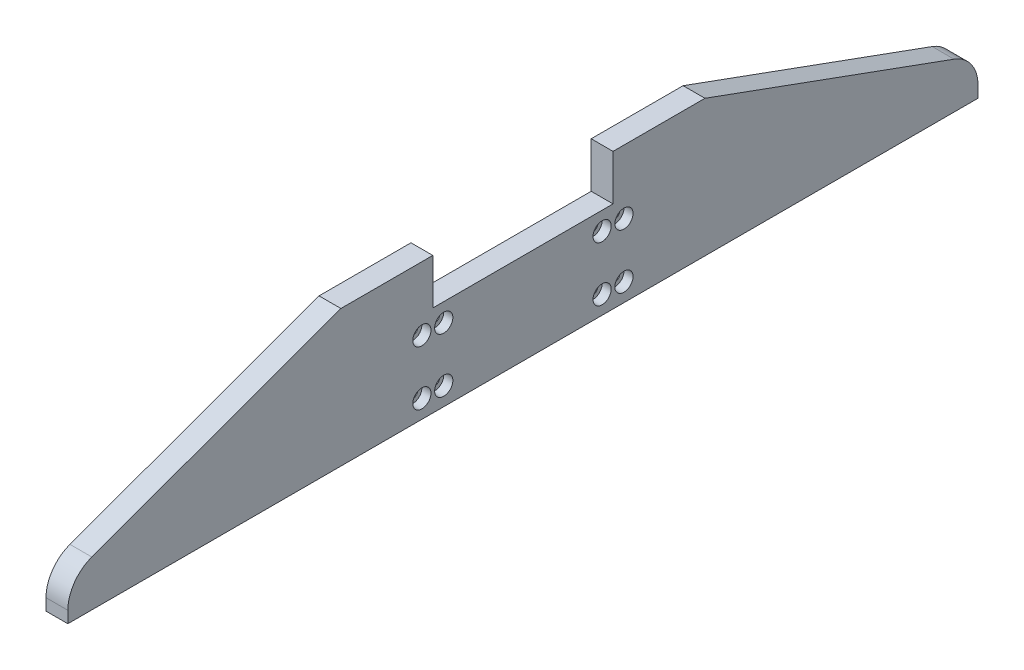
from build123d import *

# Parameters (mm, degrees)
SKETCH1_W                               = 12
SKETCH1_H                               = 75
BASE_DEPTH                              = 500
SKETCH2_W                               = 99
SKETCH2_H                               = 25
LAP_JOINT_CUTOUT_DEPTH                  = 506.736097189
LAP_JOINT_BOLT_HOLE_PATTERN_D           = 5.5
LAP_JOINT_BOLT_HOLE_PATTERN_CBORE_D     = 10
LAP_JOINT_BOLT_HOLE_PATTERN_CBORE_DEPTH = 5
CHAMFER_FRONT_SIZE                      = 150
CHAMFER_FRONT_SIZE2                     = 54.59553514
CHAMFER_REAR_SIZE                       = 150
CHAMFER_REAR_SIZE2                      = 54.59553514
BREAK_CHAMFER_CORNERS_R                 = 20
CROSS_TIE_BOLT_HOLE_PATTERN_D           = 5.5
CROSS_TIE_BOLT_HOLE_PATTERN_CBORE_D     = 10
CROSS_TIE_BOLT_HOLE_PATTERN_CBORE_DEPTH = 5


with BuildPart() as part:
    # Sketch1 → base (new body)
    with BuildSketch(Plane.XY):
        with Locations((6, 37.5)):
            Rectangle(SKETCH1_W, SKETCH1_H)
    extrude(amount=BASE_DEPTH)

    # Sketch2 → lap joint cutout (cut, through all)
    with BuildSketch(Plane.ZY):
        with Locations((250, 62.5)):
            Rectangle(SKETCH2_W, SKETCH2_H)
    extrude(amount=-LAP_JOINT_CUTOUT_DEPTH, mode=Mode.SUBTRACT)

    # lap joint bolt hole pattern (through all)
    with Locations(Plane(origin=(12, 0, 0), x_dir=(0, 0, -1), z_dir=(1, 0, 0))):
        with Locations((-293.5, 40), (-206.5, 10), (-293.5, 10), (-206.5, 40)):
            CounterBoreHole(LAP_JOINT_BOLT_HOLE_PATTERN_D / 2, LAP_JOINT_BOLT_HOLE_PATTERN_CBORE_D / 2, LAP_JOINT_BOLT_HOLE_PATTERN_CBORE_DEPTH)

    # chamfer front
    chamfer_front_edges = [part.edges().sort_by_distance(p)[0] for p in [
        (6, 75, 0),
    ]]
    chamfer_front_side = [part.faces().sort_by_distance(p)[0] for p in [
        (6, 75, 100.25),
    ]]
    chamfer(chamfer_front_edges, length=CHAMFER_FRONT_SIZE, length2=CHAMFER_FRONT_SIZE2, reference=chamfer_front_side[0])

    # chamfer rear
    chamfer_rear_edges = [part.edges().sort_by_distance(p)[0] for p in [
        (6, 75, 500),
    ]]
    chamfer_rear_side = [part.faces().sort_by_distance(p)[0] for p in [
        (6, 75, 399.75),
    ]]
    chamfer(chamfer_rear_edges, length=CHAMFER_REAR_SIZE, length2=CHAMFER_REAR_SIZE2, reference=chamfer_rear_side[0])

    # break chamfer corners
    break_chamfer_corners_edges = [part.edges().sort_by_distance(p)[0] for p in [
        (6, 20.40446486, 0),
        (6, 20.40446486, 500),
    ]]
    fillet(break_chamfer_corners_edges, radius=BREAK_CHAMFER_CORNERS_R)

    # cross tie bolt hole pattern (through all)
    with Locations(Plane(origin=(12, 0, 0), x_dir=(0, 0, -1), z_dir=(1, 0, 0))):
        with Locations((-305.5, 40), (-305.5, 10)):
            cross_tie_bolt_hole_pattern = CounterBoreHole(CROSS_TIE_BOLT_HOLE_PATTERN_D / 2, CROSS_TIE_BOLT_HOLE_PATTERN_CBORE_D / 2, CROSS_TIE_BOLT_HOLE_PATTERN_CBORE_DEPTH)

    # mirror cross tie bolt hole pattern: cross tie bolt hole pattern across plane
    add(cross_tie_bolt_hole_pattern.mirror(Plane(origin=(0, 0, 250), x_dir=(1, 0, 0), z_dir=(0, 0, -1))), mode=Mode.SUBTRACT)


solid = part.part
